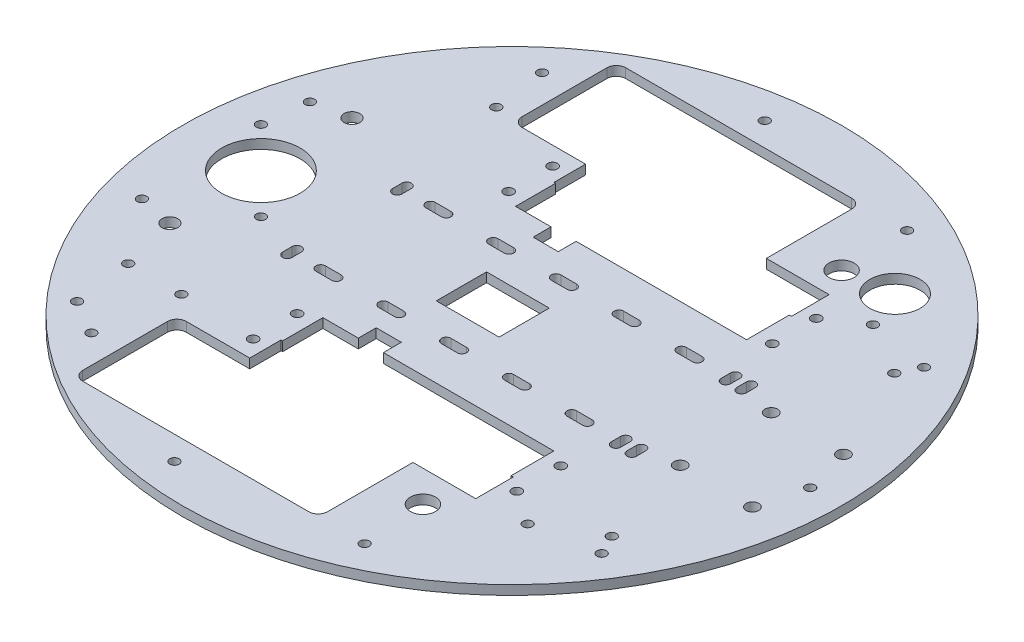
from build123d import *

# Parameters (mm, degrees)
SKETCH_2_R           = 100
EXTRUDE_1_DEPTH      = 3
SKETCH_4_R           = 12.5
CUT_EXTRUDE_2_DEPTH  = 3
SKETCH_5_R           = 1.5
CUT_EXTRUDE_3_DEPTH  = 3
SKETCH_6_R           = 4
CUT_EXTRUDE_4_DEPTH  = 10
EXTRUDE_2_DEPTH      = 3
SKETCH_11_R          = 2.5
CUT_EXTRUDE_9_DEPTH  = 10
CUT_EXTRUDE_START    = -10
SKETCH_12_R          = 174.046690734
SKETCH_12_R_2        = 100
CUT_EXTRUDE_10_DEPTH = 10
SKETCH_13_R          = 1.55
CUT_EXTRUDE_12_DEPTH = 3
SKETCH_16_R          = 2.5
SKETCH_16_W          = 12.589556248
SKETCH_16_H          = 22.605819461
CUT_EXTRUDE_14_DEPTH = 3
CUT_EXTRUDE_15_DEPTH = 3
SKETCH_18_W          = 20
SKETCH_18_H          = 16
CUT_EXTRUDE_16_DEPTH = 3
SKETCH_19_R          = 1.5
CUT_EXTRUDE_17_DEPTH = 3
SKETCH_20_R          = 1.5
CUT_EXTRUDE_18_DEPTH = 3
CUT_EXTRUDE_19_DEPTH = 3
FILLET_1_R           = 2
SKETCH_14_R          = 2
CUT_EXTRUDE_21_DEPTH = 10
EXTRUDE_START        = -3
SKETCH_22_R          = 105
SKETCH_22_R_2        = 100
EXTRUDE_3_DEPTH      = 3
CUT_EXTRUDE_22_REACH = 150.523
SKETCH_23_W          = 78
SKETCH_23_H          = 33
FILLET_2_R           = 3
SKETCH_26_W          = 5.17034178
SKETCH_26_H          = 19.680655807
SKETCH_26_W_2        = 5.503912217
SKETCH_26_H_2        = 6.004267874
SKETCH_26_H_3        = 20.251521315
SKETCH_26_H_4        = 6.909342566
EXTRUDE_4_DEPTH      = 3
SKETCH_27_R          = 1.55
CUT_EXTRUDE_23_DEPTH = 10
SKETCH_28_W          = 20
SKETCH_28_H          = 12
SKETCH_28_W_2        = 0.5
SKETCH_28_H_2        = 10
CUT_EXTRUDE_24_DEPTH = 10
SKETCH_29_W          = 18.881767469
SKETCH_29_H          = 33.04309307
SKETCH_29_W_2        = 6.55616926
SKETCH_29_H_2        = 5.638305563
EXTRUDE_5_DEPTH      = 3
SKETCH_30_R          = 1.5
CUT_EXTRUDE_25_DEPTH = 5
SKETCH_31_R          = 8
CUT_EXTRUDE_26_DEPTH = 5
CUT_EXTRUDE_START_2  = -5
SKETCH_32_R          = 2
CUT_EXTRUDE_27_DEPTH = 5
CUT_EXTRUDE_28_DEPTH = 5
CUT_EXTRUDE_29_DEPTH = 5


with BuildPart() as part:
    # 草圖2 → 填料-伸長1 (new body)
    with BuildSketch(Plane(origin=(0, 0, 0), x_dir=(1, 0, 0), z_dir=(0, 1, 0))):
        with Locations(Location((0, 0, 0), (0, 0, 270))):
            Circle(SKETCH_2_R)
    extrude(amount=EXTRUDE_1_DEPTH)

    # 草圖4 → 除料-伸長2 (cut)
    with BuildSketch(Plane(origin=(0, 3, 0), x_dir=(1, 0, 0), z_dir=(0, 1, 0))):
        with Locations(Location((-80, 0, 0), (0, 0, 270))):
            Circle(SKETCH_4_R)
    extrude(amount=-CUT_EXTRUDE_2_DEPTH, mode=Mode.SUBTRACT)

    # 草圖5 → 除料-伸長3 (cut)
    with BuildSketch(Plane(origin=(0, 3, 0), x_dir=(1, 0, 0), z_dir=(0, 1, 0))):
        with Locations(Location((-60, 55, 0), (0, 0, 270))):
            Circle(SKETCH_5_R)
        with Locations(Location((-60, -55, 0), (0, 0, 270))):
            Circle(SKETCH_5_R)
        with Locations(Location((60, -55, 0), (0, 0, 270))):
            Circle(SKETCH_5_R)
        with Locations(Location((60, 55, 0), (0, 0, 270))):
            Circle(SKETCH_5_R)
    extrude(amount=-CUT_EXTRUDE_3_DEPTH, mode=Mode.SUBTRACT)

    # 草圖6 → 除料-伸長4 (cut)
    with BuildSketch(Plane(origin=(0, 3, 0), x_dir=(1, 0, 0), z_dir=(0, 1, 0))):
        with Locations(Location((40, 65, 0), (0, 0, 270))):
            Circle(SKETCH_6_R)
        with Locations(Location((37.878902577, -66.258499376, 0), (0, 0, 270))):
            Circle(SKETCH_6_R)
    extrude(amount=-CUT_EXTRUDE_4_DEPTH, mode=Mode.SUBTRACT)

    # 草圖8 → 填料-伸長2 (add)
    with BuildSketch(Plane(origin=(0, 3, 0), x_dir=(1, 0, 0), z_dir=(0, 1, 0))):
        with BuildLine():
            Line((-99.215674165, 12.5), (-111.215674165, 12.5))
            ThreePointArc((-111.215674165, 12.5), (-113.336994508, 11.621320344), (-114.215674165, 9.5))
            Line((-114.215674165, 9.5), (-114.215674165, -9.5))
            ThreePointArc((-114.215674165, -9.5), (-113.336994508, -11.621320344), (-111.215674165, -12.5))
            Line((-111.215674165, -12.5), (-99.215674165, -12.5))
            Line((-99.215674165, -12.5), (-99.215674165, 12.5))
        make_face()
    extrude(amount=-EXTRUDE_2_DEPTH)

    # 草圖11 → 除料-伸長9 (cut)
    with BuildSketch(Plane(origin=(0, 3, 0), x_dir=(1, 0, 0), z_dir=(0, 1, 0))):
        with Locations(Location((-80, -29, 0), (0, 0, 270))):
            Circle(SKETCH_11_R)
        with Locations(Location((-80, 29, 0), (0, 0, 270))):
            Circle(SKETCH_11_R)
    extrude(amount=-CUT_EXTRUDE_9_DEPTH, mode=Mode.SUBTRACT)

    # 草圖12 → 除料-伸長10 (cut)
    with BuildSketch(Plane(origin=(0, 3, 0), x_dir=(1, 0, 0), z_dir=(0, 1, 0)).offset(CUT_EXTRUDE_START)):
        Circle(SKETCH_12_R)
        with Locations(Location((0, 0, 0), (0, 0, 270))):
            Circle(SKETCH_12_R_2, mode=Mode.SUBTRACT)
    extrude(amount=CUT_EXTRUDE_10_DEPTH, mode=Mode.SUBTRACT)

    # 草圖13 → 除料-伸長12 (cut)
    with BuildSketch(Plane(origin=(0, 3, 0), x_dir=(1, 0, 0), z_dir=(0, 1, 0))):
        Polygon((-29.565632174, 30.7), (-18.265632174, 30.7), (-18.265632174, 25), (-10.265632174, 25), (-10.265632174, 30.7), (44.034367826, 30.7), (44.034367826, 54.3), (21.734367826, 54.3), (21.734367826, 83.5), (-50.265632174, 83.5), (-50.265632174, 53.5), (-29.565632174, 53.5), align=None)
        Polygon((-50.265632174, -53.5), (-50.265632174, -83.5), (21.734367826, -83.5), (21.734367826, -54.3), (44.034367826, -54.3), (44.034367826, -30.7), (-10.265632174, -30.7), (-10.265632174, -25), (-18.265632174, -25), (-18.265632174, -30.7), (-29.565632174, -30.7), (-29.565632174, -53.5), align=None)
        with Locations(Location((-34.765632174, 34.5, 0), (0, 0, 270))):
            Circle(SKETCH_13_R)
        with Locations(Location((49.234367826, 48.5, 0), (0, 0, 270))):
            Circle(SKETCH_13_R)
        with Locations(Location((-34.765632174, 48.5, 0), (0, 0, 270))):
            Circle(SKETCH_13_R)
        with Locations(Location((-34.765632174, -34.5, 0), (0, 0, 90))):
            Circle(SKETCH_13_R)
        with Locations(Location((49.234367826, -48.5, 0), (0, 0, 90))):
            Circle(SKETCH_13_R)
        with Locations(Location((-34.765632174, -48.5, 0), (0, 0, 90))):
            Circle(SKETCH_13_R)
    extrude(amount=-CUT_EXTRUDE_12_DEPTH, mode=Mode.SUBTRACT)

    # 草圖16 → 除料-伸長14 (cut)
    with BuildSketch(Plane(origin=(0, 3, 0), x_dir=(1, 0, 0), z_dir=(0, 1, 0))):
        with Locations(Location((-80, -29, 0), (0, 0, 270))):
            Circle(SKETCH_16_R)
        with Locations((-54.997597322, -34.199999445)):
            Rectangle(SKETCH_16_W, SKETCH_16_H)
        with BuildLine():
            ThreePointArc((-55.590776571, -48.961959498), (-54.990689623, -49.149997849), (-54.390776699, -48.961405034))
            ThreePointArc((-54.390776699, -48.961405034), (-54.060336989, -48.585838478), (-53.941174779, -48.099997961))
            ThreePointArc((-53.941174779, -48.099997961), (-55.477445341, -47.169384754), (-55.590776571, -48.961959498))
        make_face()
        with BuildLine():
            ThreePointArc((-54.404418073, -19.438039392), (-55.004505021, -19.250001041), (-55.604417945, -19.438593856))
            ThreePointArc((-55.604417945, -19.438593856), (-55.489860382, -21.230838719), (-53.954019865, -20.300000929))
            ThreePointArc((-53.954019865, -20.300000929), (-54.073406658, -19.813730367), (-54.404418073, -19.438039392))
        make_face()
    extrude(amount=-CUT_EXTRUDE_14_DEPTH, mode=Mode.SUBTRACT)

    # 草圖17 → 除料-伸長15 (cut)
    with BuildSketch(Plane.XZ):
        with BuildLine():
            Line((36.534367826, 19.000000035), (41.534367826, 19.000000035))
            ThreePointArc((41.534367826, 19.000000035), (43.034367826, 17.500000035), (41.534367826, 16.000000035))
            Line((41.534367826, 16.000000035), (36.534367826, 16.000000035))
            ThreePointArc((36.534367826, 16.000000035), (35.034367826, 17.500000035), (36.534367826, 19.000000035))
        make_face()
        with BuildLine():
            Line((16.534367826, 16.000000035), (21.534367826, 16.000000035))
            ThreePointArc((21.534367826, 16.000000035), (23.034367826, 17.500000035), (21.534367826, 19.000000035))
            Line((21.534367826, 19.000000035), (16.534367826, 19.000000035))
            ThreePointArc((16.534367826, 19.000000035), (15.034367826, 17.500000035), (16.534367826, 16.000000035))
        make_face()
        with BuildLine():
            Line((-3.465632174, 16.000000035), (1.534367826, 16.000000035))
            ThreePointArc((1.534367826, 16.000000035), (3.034367826, 17.500000035), (1.534367826, 19.000000035))
            Line((1.534367826, 19.000000035), (-3.465632174, 19.000000035))
            ThreePointArc((-3.465632174, 19.000000035), (-4.965632174, 17.500000035), (-3.465632174, 16.000000035))
        make_face()
        with BuildLine():
            Line((-23.465632174, 16.000000035), (-18.465632174, 16.000000035))
            ThreePointArc((-18.465632174, 16.000000035), (-16.965632174, 17.500000035), (-18.465632174, 19.000000035))
            Line((-18.465632174, 19.000000035), (-23.465632174, 19.000000035))
            ThreePointArc((-23.465632174, 19.000000035), (-24.965632174, 17.500000035), (-23.465632174, 16.000000035))
        make_face()
        with BuildLine():
            Line((36.534367826, -19.000000035), (41.534367826, -19.000000035))
            ThreePointArc((41.534367826, -19.000000035), (43.034367826, -17.500000035), (41.534367826, -16.000000035))
            Line((41.534367826, -16.000000035), (36.534367826, -16.000000035))
            ThreePointArc((36.534367826, -16.000000035), (35.034367826, -17.500000035), (36.534367826, -19.000000035))
        make_face()
        with BuildLine():
            Line((16.534367826, -19.000000035), (21.534367826, -19.000000035))
            ThreePointArc((21.534367826, -19.000000035), (23.034367826, -17.500000035), (21.534367826, -16.000000035))
            Line((21.534367826, -16.000000035), (16.534367826, -16.000000035))
            ThreePointArc((16.534367826, -16.000000035), (15.034367826, -17.500000035), (16.534367826, -19.000000035))
        make_face()
        with BuildLine():
            Line((-3.465632174, -19.000000035), (1.534367826, -19.000000035))
            ThreePointArc((1.534367826, -19.000000035), (3.034367826, -17.500000035), (1.534367826, -16.000000035))
            Line((1.534367826, -16.000000035), (-3.465632174, -16.000000035))
            ThreePointArc((-3.465632174, -16.000000035), (-4.965632174, -17.500000035), (-3.465632174, -19.000000035))
        make_face()
        with BuildLine():
            Line((-23.465632174, -19.000000035), (-18.465632174, -19.000000035))
            ThreePointArc((-18.465632174, -19.000000035), (-16.965632174, -17.500000035), (-18.465632174, -16.000000035))
            Line((-18.465632174, -16.000000035), (-23.465632174, -16.000000035))
            ThreePointArc((-23.465632174, -16.000000035), (-24.965632174, -17.500000035), (-23.465632174, -19.000000035))
        make_face()
    extrude(amount=-CUT_EXTRUDE_15_DEPTH, mode=Mode.SUBTRACT)

    # 草圖18 → 除料-伸長16 (cut)
    with BuildSketch(Plane.XZ):
        with Locations((-6.115632174, 0)):
            Rectangle(SKETCH_18_W, SKETCH_18_H)
    extrude(amount=-CUT_EXTRUDE_16_DEPTH, mode=Mode.SUBTRACT)

    # 草圖19 → 除料-伸長17 (cut)
    with BuildSketch(Plane(origin=(0, 3, 0), x_dir=(1, 0, 0), z_dir=(0, 1, 0))):
        with Locations(Location((-92.727922061, 12.727922061, 0), (0, 0, 270))):
            Circle(SKETCH_19_R)
        with Locations(Location((-67.272077939, -12.727922061, 0), (0, 0, 270))):
            Circle(SKETCH_19_R)
    extrude(amount=-CUT_EXTRUDE_17_DEPTH, mode=Mode.SUBTRACT)

    # 草圖20 → 除料-伸長18 (cut)
    with BuildSketch(Plane.XZ):
        with Locations(Location((95, 0, 0), (0, 0, 270))):
            Circle(SKETCH_20_R)
        with Locations(Location((79.919085619, -51.360877658, 0), (0, 0, 270))):
            Circle(SKETCH_20_R)
        with Locations(Location((39.464426235, -86.415039559, 0), (0, 0, 270))):
            Circle(SKETCH_20_R)
        with Locations(Location((-13.519909636, -94.033036979, 0), (0, 0, 270))):
            Circle(SKETCH_20_R)
        with Locations(Location((-62.211769725, -71.796209564, 0), (0, 0, 270))):
            Circle(SKETCH_20_R)
        with Locations(Location((-91.151832493, -26.7645929, 0), (0, 0, 270))):
            Circle(SKETCH_20_R)
        with Locations(Location((-91.151832493, 26.7645929, 0), (0, 0, 270))):
            Circle(SKETCH_20_R)
        with Locations(Location((-62.211769725, 71.796209564, 0), (0, 0, 270))):
            Circle(SKETCH_20_R)
        with Locations(Location((-13.519909636, 94.033036979, 0), (0, 0, 270))):
            Circle(SKETCH_20_R)
        with Locations(Location((39.464426235, 86.415039559, 0), (0, 0, 270))):
            Circle(SKETCH_20_R)
        with Locations(Location((79.919085619, 51.360877658, 0), (0, 0, 270))):
            Circle(SKETCH_20_R)
    extrude(amount=-CUT_EXTRUDE_18_DEPTH, mode=Mode.SUBTRACT)

    # 草圖21 → 除料-伸長19 (cut)
    with BuildSketch(Plane.XZ):
        with BuildLine():
            Line((50.642037027, -19.000000035), (50.642037027, -16.000000035))
            ThreePointArc((50.642037027, -16.000000035), (52.142037027, -14.500000035), (53.642037027, -16.000000035))
            Line((53.642037027, -16.000000035), (53.642037027, -19.000000035))
            ThreePointArc((53.642037027, -19.000000035), (52.142037027, -20.500000035), (50.642037027, -19.000000035))
        make_face()
        with BuildLine():
            Line((55.642037027, -19.000000035), (55.642037027, -16.000000035))
            ThreePointArc((55.642037027, -16.000000035), (57.142037027, -14.500000035), (58.642037027, -16.000000035))
            Line((58.642037027, -16.000000035), (58.642037027, -19.000000035))
            ThreePointArc((58.642037027, -19.000000035), (57.142037027, -20.500000035), (55.642037027, -19.000000035))
        make_face()
        with BuildLine():
            Line((55.642037027, 19.000000035), (55.642037027, 16.000000035))
            ThreePointArc((55.642037027, 16.000000035), (57.142037027, 14.500000035), (58.642037027, 16.000000035))
            Line((58.642037027, 16.000000035), (58.642037027, 19.000000035))
            ThreePointArc((58.642037027, 19.000000035), (57.142037027, 20.500000035), (55.642037027, 19.000000035))
        make_face()
        with BuildLine():
            Line((50.642037027, 19.000000035), (50.642037027, 16.000000035))
            ThreePointArc((50.642037027, 16.000000035), (52.142037027, 14.500000035), (53.642037027, 16.000000035))
            Line((53.642037027, 16.000000035), (53.642037027, 19.000000035))
            ThreePointArc((53.642037027, 19.000000035), (52.142037027, 20.500000035), (50.642037027, 19.000000035))
        make_face()
    extrude(amount=-CUT_EXTRUDE_19_DEPTH, mode=Mode.SUBTRACT)

    # 圓角1
    fillet_1_edges = [part.edges().sort_by_distance(p)[0] for p in [
        (21.734367826, 1.5, 83.5),
        (-50.265632174, 1.5, 83.5),
        (-50.265632174, 1.5, 53.5),
        (-50.265632174, 1.5, -53.5),
        (-50.265632174, 1.5, -83.5),
        (21.734367826, 1.5, -83.5),
    ]]
    fillet(fillet_1_edges, radius=FILLET_1_R)

    # 草圖14 → 除料-伸長21 (cut)
    with BuildSketch(Plane(origin=(0, 3, 0), x_dir=(1, 0, 0), z_dir=(0, 1, 0))):
        with Locations(Location((91.099215454, 14.5, 0), (0, 0, 270))):
            Circle(SKETCH_14_R)
        with Locations(Location((91.099215454, -14.5, 0), (0, 0, 270))):
            Circle(SKETCH_14_R)
        with Locations(Location((68.099215454, -14.5, 0), (0, 0, 270))):
            Circle(SKETCH_14_R)
    extrude(amount=-CUT_EXTRUDE_21_DEPTH, mode=Mode.SUBTRACT)

    # 草圖22 → 填料-伸長3 (add)
    with BuildSketch(Plane(origin=(0, 3, 0), x_dir=(1, 0, 0), z_dir=(0, 1, 0)).offset(EXTRUDE_START)):
        with Locations(Location((0, 0, 0), (0, 0, 270))):
            Circle(SKETCH_22_R)
        Circle(SKETCH_22_R_2, mode=Mode.SUBTRACT)
    extrude(amount=EXTRUDE_3_DEPTH)

    # 草圖23 → 除料-伸長22 (cut, up to next)
    with BuildSketch(Plane(origin=(0, 3, 0), x_dir=(1, 0, 0), z_dir=(0, 1, 0)), mode=Mode.PRIVATE) as cut_extrude_22_sk1:
        with Locations((-14.265632174, -70)):
            Rectangle(SKETCH_23_W, SKETCH_23_H)
    cut_extrude_22_tool1 = extrude(cut_extrude_22_sk1.sketch, amount=-CUT_EXTRUDE_22_REACH, mode=Mode.PRIVATE) & part.part
    # 草圖23 → 除料-伸長22 (cut, up to next)
    with BuildSketch(Plane(origin=(0, 3, 0), x_dir=(1, 0, 0), z_dir=(0, 1, 0)), mode=Mode.PRIVATE) as cut_extrude_22_sk2:
        with Locations((-14.265632174, 70)):
            Rectangle(SKETCH_23_W, SKETCH_23_H)
    cut_extrude_22_tool2 = extrude(cut_extrude_22_sk2.sketch, amount=-CUT_EXTRUDE_22_REACH, mode=Mode.PRIVATE) & part.part
    add(cut_extrude_22_tool1.solids().sort_by_distance((-14.265632, 3, 70))[0], mode=Mode.SUBTRACT)
    add(cut_extrude_22_tool2.solids().sort_by_distance((-14.265632, 3, -70))[0], mode=Mode.SUBTRACT)

    # 圓角2
    fillet_2_edges = [part.edges().sort_by_distance(p)[0] for p in [
        (-53.265632174, 1.5, 86.5),
        (-53.265632174, 1.5, 53.5),
        (24.734367826, 1.5, 86.5),
        (-53.265632174, 1.5, -53.5),
        (-53.265632174, 1.5, -86.5),
        (24.734367826, 1.5, -86.5),
    ]]
    fillet(fillet_2_edges, radius=FILLET_2_R)

    # 草圖26 → 填料-伸長4 (add)
    with BuildSketch(Plane(origin=(0, 3, 0), x_dir=(1, 0, 0), z_dir=(0, 1, 0))):
        with Locations((-34.954832613, 41.559234759)):
            Rectangle(SKETCH_26_W, SKETCH_26_H)
        with Locations((49.271702832, 48.397428725)):
            Rectangle(SKETCH_26_W_2, SKETCH_26_H_2)
        with Locations((-34.954832613, -41.41280274)):
            Rectangle(SKETCH_26_W, SKETCH_26_H_3)
        with Locations((49.271702832, -48.083892115)):
            Rectangle(SKETCH_26_W_2, SKETCH_26_H_4)
    extrude(amount=-EXTRUDE_4_DEPTH)

    # 草圖27 → 除料-伸長23 (cut)
    with BuildSketch(Plane.XZ):
        with Locations(Location((-34.765632174, 47.7, 0), (0, 0, 270))):
            Circle(SKETCH_27_R)
        with Locations(Location((-34.765632174, 33.7, 0), (0, 0, 270))):
            Circle(SKETCH_27_R)
        with Locations(Location((49.234367826, 47.7, 0), (0, 0, 270))):
            Circle(SKETCH_27_R)
        with Locations(Location((49.234367826, 33.7, 0), (0, 0, 270))):
            Circle(SKETCH_27_R)
        with Locations(Location((49.234367826, -33.7, 0), (0, 0, 270))):
            Circle(SKETCH_27_R)
        with Locations(Location((49.234367826, -47.7, 0), (0, 0, 270))):
            Circle(SKETCH_27_R)
        with Locations(Location((-34.765632174, -33.7, 0), (0, 0, 270))):
            Circle(SKETCH_27_R)
        with Locations(Location((-34.765632174, -47.7, 0), (0, 0, 270))):
            Circle(SKETCH_27_R)
    extrude(amount=-CUT_EXTRUDE_23_DEPTH, mode=Mode.SUBTRACT)

    # 草圖28 → 除料-伸長24 (cut)
    with BuildSketch(Plane.XZ):
        with Locations((34.734367826, -50.3)):
            Rectangle(SKETCH_28_W, SKETCH_28_H)
        with Locations((34.734367826, 50.3)):
            Rectangle(SKETCH_28_W, SKETCH_28_H)
        with Locations((-29.815632174, 48.5)):
            Rectangle(SKETCH_28_W_2, SKETCH_28_H_2)
        with Locations((-29.815632174, -48.5)):
            Rectangle(SKETCH_28_W_2, SKETCH_28_H_2)
    extrude(amount=-CUT_EXTRUDE_24_DEPTH, mode=Mode.SUBTRACT)

    # 草圖29 → 填料-伸長5 (add)
    with BuildSketch(Plane.XZ):
        with Locations((-55.204527891, 34.112568951)):
            Rectangle(SKETCH_29_W, SKETCH_29_H)
        with Locations((-59.662722987, 54.895625505)):
            Rectangle(SKETCH_29_W_2, SKETCH_29_H_2)
    extrude(amount=-EXTRUDE_5_DEPTH)

    # 草圖30 → 除料-伸長25 (cut)
    with BuildSketch(Plane.XZ):
        with Locations(Location((76.804663743, 45, 0), (0, 0, 270))):
            Circle(SKETCH_30_R)
        with Locations(Location((76.804663743, -45, 0), (0, 0, 270))):
            Circle(SKETCH_30_R)
        with Locations(Location((-73.186907756, 65.380521954, 0), (0, 0, 270))):
            Circle(SKETCH_30_R)
        with Locations(Location((-58.538151314, 46.79796308, 0), (0, 0, 270))):
            Circle(SKETCH_30_R)
        with Locations(Location((-75.479360864, 46.79796308, 0), (0, 0, 270))):
            Circle(SKETCH_30_R)
    extrude(amount=-CUT_EXTRUDE_25_DEPTH, mode=Mode.SUBTRACT)

    # 草圖31 → 除料-伸長26 (cut)
    with BuildSketch(Plane.XZ):
        with Locations(Location((55.015900971, -67.00542863, 0), (0, 0, 270))):
            Circle(SKETCH_31_R)
    extrude(amount=-CUT_EXTRUDE_26_DEPTH, mode=Mode.SUBTRACT)

    # 草圖32 → 除料-伸長27 (cut)
    with BuildSketch(Plane.XZ.offset(CUT_EXTRUDE_START_2)):
        with Locations(Location((91.099215454, -14.5, 0), (0, 0, 90))):
            Circle(SKETCH_32_R)
        with Locations(Location((68.099215454, -14.5, 0), (0, 0, 90))):
            Circle(SKETCH_32_R)
    extrude(amount=CUT_EXTRUDE_27_DEPTH, mode=Mode.SUBTRACT)

    # 草圖33 → 除料-伸長28 (cut)
    with BuildSketch(Plane.XZ):
        with BuildLine():
            Line((-23.465632174, -19.000000035), (-18.465632174, -19.000000035))
            ThreePointArc((-18.465632174, -19.000000035), (-16.965632174, -17.500000035), (-18.465632174, -16.000000035))
            Line((-18.465632174, -16.000000035), (-23.465632174, -16.000000035))
            ThreePointArc((-23.465632174, -16.000000035), (-24.965632174, -17.500000035), (-23.465632174, -19.000000035))
        make_face()
        with BuildLine():
            Line((-18.465632174, 19.000000035), (-23.465632174, 19.000000035))
            ThreePointArc((-23.465632174, 19.000000035), (-24.965632174, 17.500000035), (-23.465632174, 16.000000035))
            Line((-23.465632174, 16.000000035), (-18.465632174, 16.000000035))
            ThreePointArc((-18.465632174, 16.000000035), (-16.965632174, 17.500000035), (-18.465632174, 19.000000035))
        make_face()
        with BuildLine():
            Line((-43.465632174, 16.000000035), (-38.465632174, 16.000000035))
            ThreePointArc((-38.465632174, 16.000000035), (-36.965632174, 17.500000035), (-38.465632174, 19.000000035))
            Line((-38.465632174, 19.000000035), (-43.465632174, 19.000000035))
            ThreePointArc((-43.465632174, 19.000000035), (-44.965632174, 17.500000035), (-43.465632174, 16.000000035))
        make_face()
        with BuildLine():
            Line((-38.465632174, -16.000000035), (-43.465632174, -16.000000035))
            ThreePointArc((-43.465632174, -16.000000035), (-44.965632174, -17.500000035), (-43.465632174, -19.000000035))
            Line((-43.465632174, -19.000000035), (-38.465632174, -19.000000035))
            ThreePointArc((-38.465632174, -19.000000035), (-36.965632174, -17.500000035), (-38.465632174, -16.000000035))
        make_face()
    extrude(amount=-CUT_EXTRUDE_28_DEPTH, mode=Mode.SUBTRACT)

    # 草圖34 → 除料-伸長29 (cut)
    with BuildSketch(Plane.XZ):
        with BuildLine():
            Line((50.642037027, -16.000000035), (50.642037027, -19.000000035))
            ThreePointArc((50.642037027, -19.000000035), (52.142037027, -20.500000035), (53.642037027, -19.000000035))
            Line((53.642037027, -19.000000035), (53.642037027, -16.000000035))
            ThreePointArc((53.642037027, -16.000000035), (52.142037027, -14.500000035), (50.642037027, -16.000000035))
        make_face()
        with BuildLine():
            Line((50.642037027, 19.000000035), (50.642037027, 16.000000035))
            ThreePointArc((50.642037027, 16.000000035), (52.142037027, 14.500000035), (53.642037027, 16.000000035))
            Line((53.642037027, 16.000000035), (53.642037027, 19.000000035))
            ThreePointArc((53.642037027, 19.000000035), (52.142037027, 20.500000035), (50.642037027, 19.000000035))
        make_face()
        with BuildLine():
            Line((-51.075557607, -16.000000035), (-51.075557607, -19.000000035))
            ThreePointArc((-51.075557607, -19.000000035), (-52.575557607, -20.500000035), (-54.075557607, -19.000000035))
            Line((-54.075557607, -19.000000035), (-54.075557607, -16.000000035))
            ThreePointArc((-54.075557607, -16.000000035), (-52.575557607, -14.500000035), (-51.075557607, -16.000000035))
        make_face()
        with BuildLine():
            Line((-51.075557607, 19.000000035), (-51.075557607, 16.000000035))
            ThreePointArc((-51.075557607, 16.000000035), (-52.575557607, 14.500000035), (-54.075557607, 16.000000035))
            Line((-54.075557607, 16.000000035), (-54.075557607, 19.000000035))
            ThreePointArc((-54.075557607, 19.000000035), (-52.575557607, 20.500000035), (-51.075557607, 19.000000035))
        make_face()
    extrude(amount=-CUT_EXTRUDE_29_DEPTH, mode=Mode.SUBTRACT)


solid = part.part
